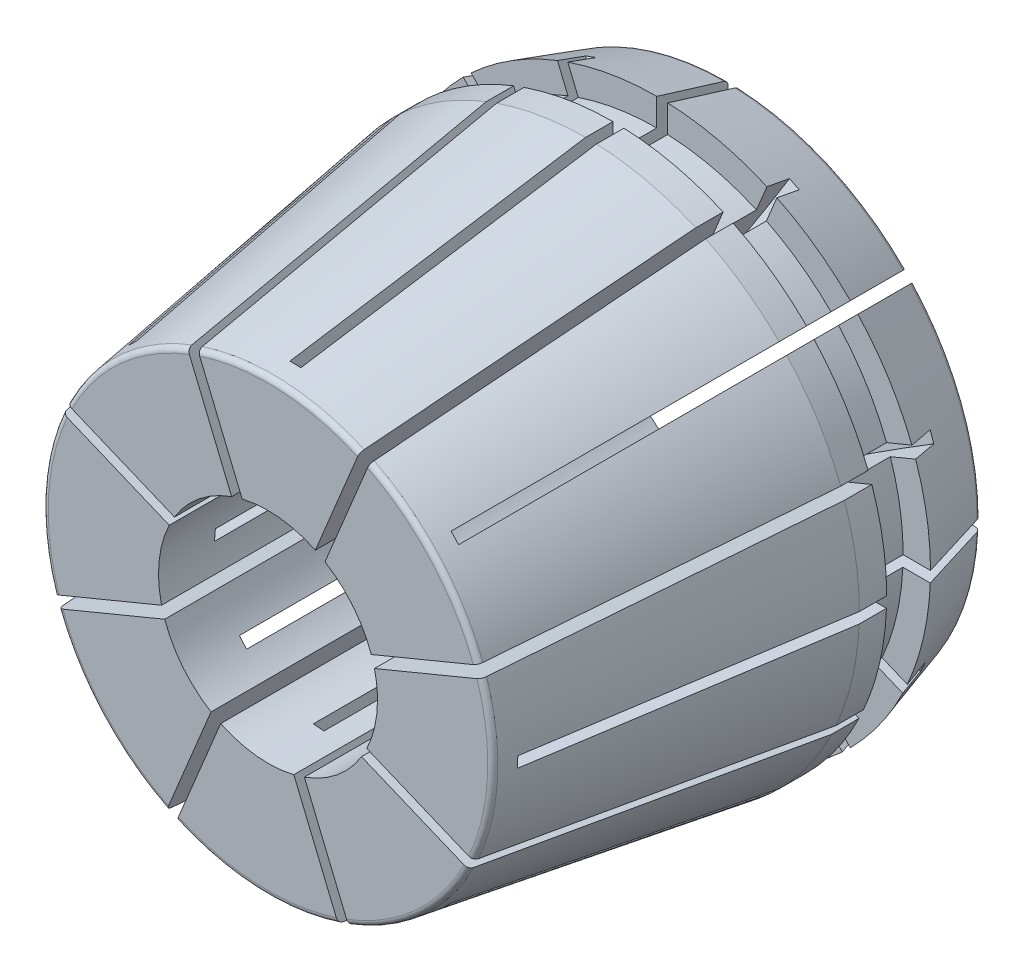
from build123d import *

# Parameters (mm, degrees)
FILLET1_R          = 0.5
FILLET2_R          = 0.5
CUT_EXTRUDE1_DEPTH = 1
CIRPATTERN1_COUNT  = 8
CUT_EXTRUDE3_DEPTH = 1
CIRPATTERN2_COUNT  = 8


with BuildPart() as part:
    # Sketch1 → Revolve1 (revolve)
    with BuildSketch(Plane(origin=(0, 0, 0), x_dir=(1, 0, 0), z_dir=(0, 1, 0))):
        Polygon((23, 100), (10, 100), (10, 58), (20.5, 58), (25, 87), (25, 89.5), (22.5, 89.5), (22.5, 93.5), (25, 93.5), align=None)
    revolve(axis=Axis((0, 0, -58), (0, 0, -1)))

    # Fillet1
    fillet1_edges = [part.edges().sort_by_distance(p)[0] for p in [
        (-23, 0, -100),
    ]]
    fillet(fillet1_edges, radius=FILLET1_R)

    # Fillet2
    fillet2_edges = [part.edges().sort_by_distance(p)[0] for p in [
        (-20.5, 0, -58),
    ]]
    fillet(fillet2_edges, radius=FILLET2_R)

    # Sketch2 → Cut-Extrude1 (cut)
    with BuildSketch(Plane(origin=(0, 0, 0), x_dir=(0, 0, -1), z_dir=(1, 0, 0))):
        with BuildLine():
            Line((81, 0), (102, 0))
            Line((102, 0), (102, -21))
            ThreePointArc((102, -21), (66.150757595, -35.849242405), (81, 0))
        make_face()
    cut_extrude1 = extrude(amount=-CUT_EXTRUDE1_DEPTH, mode=Mode.SUBTRACT)

    # CirPattern1: Cut-Extrude1 ×8 about axis
    cirpattern1_axis = Axis((0, 0, 0), (0, 0, 1))
    for i in range(1, CIRPATTERN1_COUNT):
        add(cut_extrude1.rotate(cirpattern1_axis, i * 360 / CIRPATTERN1_COUNT), mode=Mode.SUBTRACT)

    # Sketch4 → Cut-Extrude3 (cut)
    with BuildSketch(Plane(origin=(0.207106781, -0.5, 0), x_dir=(0.9238795325112851, 0.3826834323650939, 0), z_dir=(-0.3826834323650939, 0.9238795325112851, 0))):
        with BuildLine():
            Line((0, 14.651559068), (42.674220466, 14.651559068))
            ThreePointArc((42.674220466, 14.651559068), (84.079576898, 67.654649325), (22.630712673, 95))
            ThreePointArc((22.630712673, 95), (6.092598284, 79.300173973), (0, 57.325779534))
            Line((0, 57.325779534), (0, 14.651559068))
        make_face()
    cut_extrude3 = extrude(amount=-CUT_EXTRUDE3_DEPTH, mode=Mode.SUBTRACT)

    # CirPattern2: Cut-Extrude3 ×8 about axis
    cirpattern2_axis = Axis((0, 0, 0), (0, 0, 1))
    for i in range(1, CIRPATTERN2_COUNT):
        add(cut_extrude3.rotate(cirpattern2_axis, i * 360 / CIRPATTERN2_COUNT), mode=Mode.SUBTRACT)


solid = part.part
